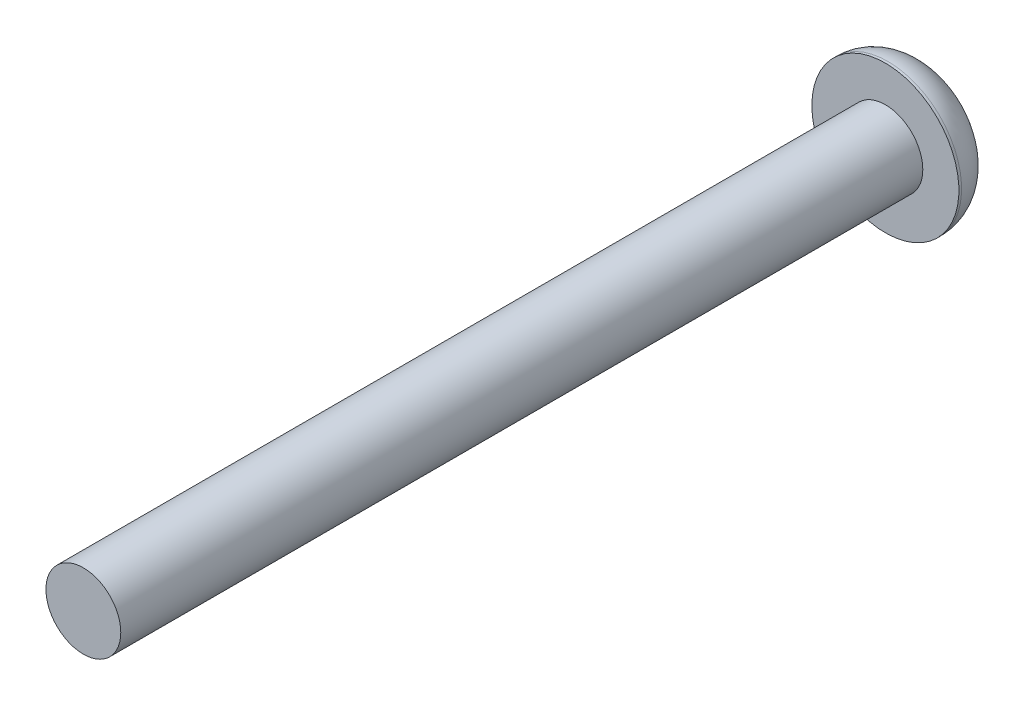
from build123d import *

# Parameters (mm, degrees)
SKETCH1_R           = 1.4
BOSS_EXTRUDE1_DEPTH = 30
SKETCH2_R           = 2.75
BOSS_EXTRUDE2_DEPTH = 1.6
FILLET1_R           = 1.5


with BuildPart() as part:
    # Sketch1 → Boss-Extrude1 (new body)
    with BuildSketch(Plane.XY):
        Circle(SKETCH1_R)
    extrude(amount=BOSS_EXTRUDE1_DEPTH)

    # Sketch2 → Boss-Extrude2 (add)
    with BuildSketch(Plane(origin=(0, 0, 0), x_dir=(-1, 0, 0), z_dir=(0, 0, -1))):
        Circle(SKETCH2_R)
    extrude(amount=BOSS_EXTRUDE2_DEPTH)

    # Fillet1
    fillet1_edges = [part.edges().sort_by_distance(p)[0] for p in [
        (2.75, 0, -1.6),
    ]]
    fillet(fillet1_edges, radius=FILLET1_R)


solid = part.part
